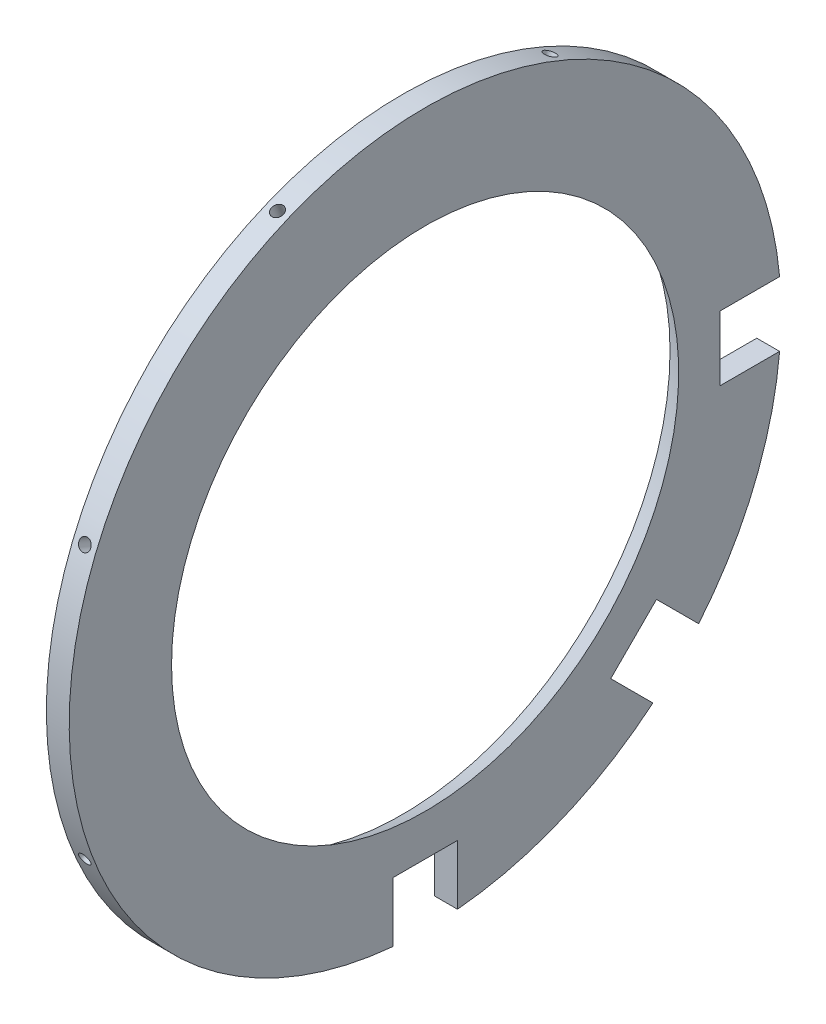
from build123d import *

# Parameters (mm, degrees)
NOTCH_180_SKETCH_W   = 18
NOTCH_180_SKETCH_H   = 19
NOTCH_180_DEPTH      = 4.175
NOTCH_225_DEPTH      = 4.175
NOTCH_270_SKETCH_W   = 19
NOTCH_270_SKETCH_H   = 18
NOTCH_270_DEPTH      = 4.175
SCREW_HOLE_SKETCH_W  = 1.65
SCREW_HOLE_SKETCH_H  = 9
SCREW_HOLES_X8_COUNT = 8


with BuildPart() as part:
    # Ring Sketch → Ring (revolve)
    with BuildSketch(Plane.XY):
        Polygon((3.175, 70.5315), (3.175, 99), (-3.175, 99), (-3.175, 74.4685), align=None)
    revolve(axis=Axis((-300, 0, 0), (1, 0, 0)))

    # Notch 180 Sketch → Notch 180 (cut, symmetric)
    with BuildSketch(Plane(origin=(0, 0, 0), x_dir=(0, 0, -1), z_dir=(1, 0, 0))):
        with Locations((0, -91.5)):
            Rectangle(NOTCH_180_SKETCH_W, NOTCH_180_SKETCH_H)
    extrude(amount=NOTCH_180_DEPTH, both=True, mode=Mode.SUBTRACT)

    # Notch 225 Sketch → Notch 225 (cut, symmetric)
    with BuildSketch(Plane(origin=(0, 0, 0), x_dir=(0, 0, -1), z_dir=(1, 0, 0))):
        Polygon((51.618795027, -64.346717088), (64.346717088, -51.618795027), (77.781745931, -65.053823869), (65.053823869, -77.781745931), align=None)
    extrude(amount=NOTCH_225_DEPTH, both=True, mode=Mode.SUBTRACT)

    # Notch 270 Sketch → Notch 270 (cut, symmetric)
    with BuildSketch(Plane(origin=(0, 0, 0), x_dir=(0, 0, -1), z_dir=(1, 0, 0))):
        with Locations((91.5, 0)):
            Rectangle(NOTCH_270_SKETCH_W, NOTCH_270_SKETCH_H)
    extrude(amount=NOTCH_270_DEPTH, both=True, mode=Mode.SUBTRACT)

    # Screw Hole Sketch → Screw Hole (revolve, cut)
    with BuildSketch(Plane(origin=(0, 0, 0), x_dir=(-1, 0, 0), z_dir=(0, -0.3826834323650898, 0.9238795325112867))):
        with Locations((-0.825, -95.5)):
            Rectangle(SCREW_HOLE_SKETCH_W, SCREW_HOLE_SKETCH_H)
    screw_hole = revolve(axis=Axis((0, 81.301398861, 33.676142048), (0, 0.9238795325112867, 0.38268343236509)), mode=Mode.SUBTRACT)

    # Screw Holes x8: Screw Hole ×8 about axis
    screw_holes_x8_axis = Axis((3.4925, 0, 0), (-1, 0, 0))
    for i in range(1, SCREW_HOLES_X8_COUNT):
        add(screw_hole.rotate(screw_holes_x8_axis, i * 360 / SCREW_HOLES_X8_COUNT), mode=Mode.SUBTRACT)


solid = part.part
